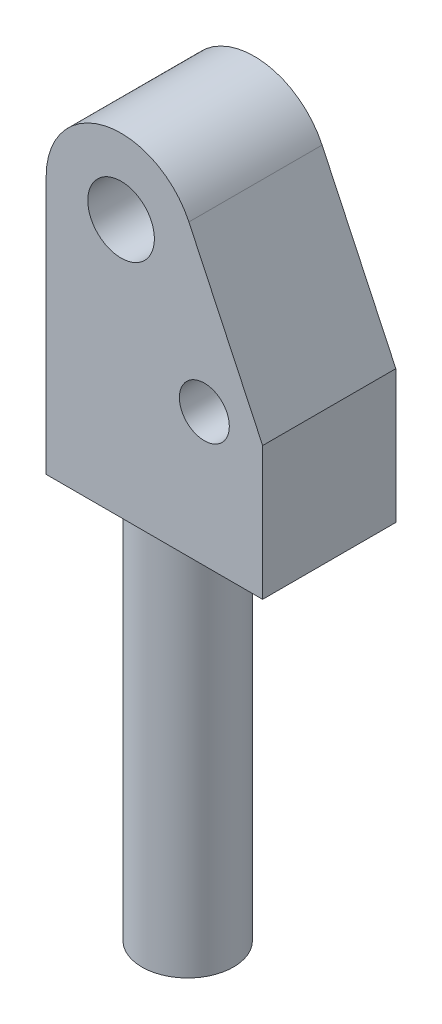
from build123d import *

# Parameters (mm, degrees)
SKETCH1_R           = 5.5
BOSS_EXTRUDE1_DEPTH = 48
SKETCH3_R           = 4
SKETCH3_R_2         = 3
BOSS_EXTRUDE2_DEPTH = 8
CHAMFER1_SIZE       = 1


with BuildPart() as part:
    # Sketch1 → Boss-Extrude1 (new body)
    with BuildSketch(Plane(origin=(0, 0, 0), x_dir=(1, 0, 0), z_dir=(0, 1, 0))):
        with Locations(Location((0, 0, 0), (0, 0, 270))):
            Circle(SKETCH1_R)
    extrude(amount=BOSS_EXTRUDE1_DEPTH)

    # Sketch3 → Boss-Extrude2 (add, symmetric)
    with BuildSketch(Plane.XY):
        with BuildLine():
            Line((0, 48), (17, 48))
            Line((17, 48), (17, 64))
            Line((17, 64), (8.144295771, 82.830201874))
            ThreePointArc((8.144295771, 82.830201874), (-1.962312164, 87.783469188), (-9, 79))
            Line((-9, 79), (-9, 48))
            Line((-9, 48), (0, 48))
        make_face()
        with Locations((0, 79)):
            Circle(SKETCH3_R, mode=Mode.SUBTRACT)
        with Locations((10, 64)):
            Circle(SKETCH3_R_2, mode=Mode.SUBTRACT)
    extrude(amount=BOSS_EXTRUDE2_DEPTH, both=True)

    # Chamfer1
    chamfer1_edges = [part.edges().sort_by_distance(p)[0] for p in [
        (0, 48, -5.5),
    ]]
    chamfer(chamfer1_edges, length=CHAMFER1_SIZE)


solid = part.part
